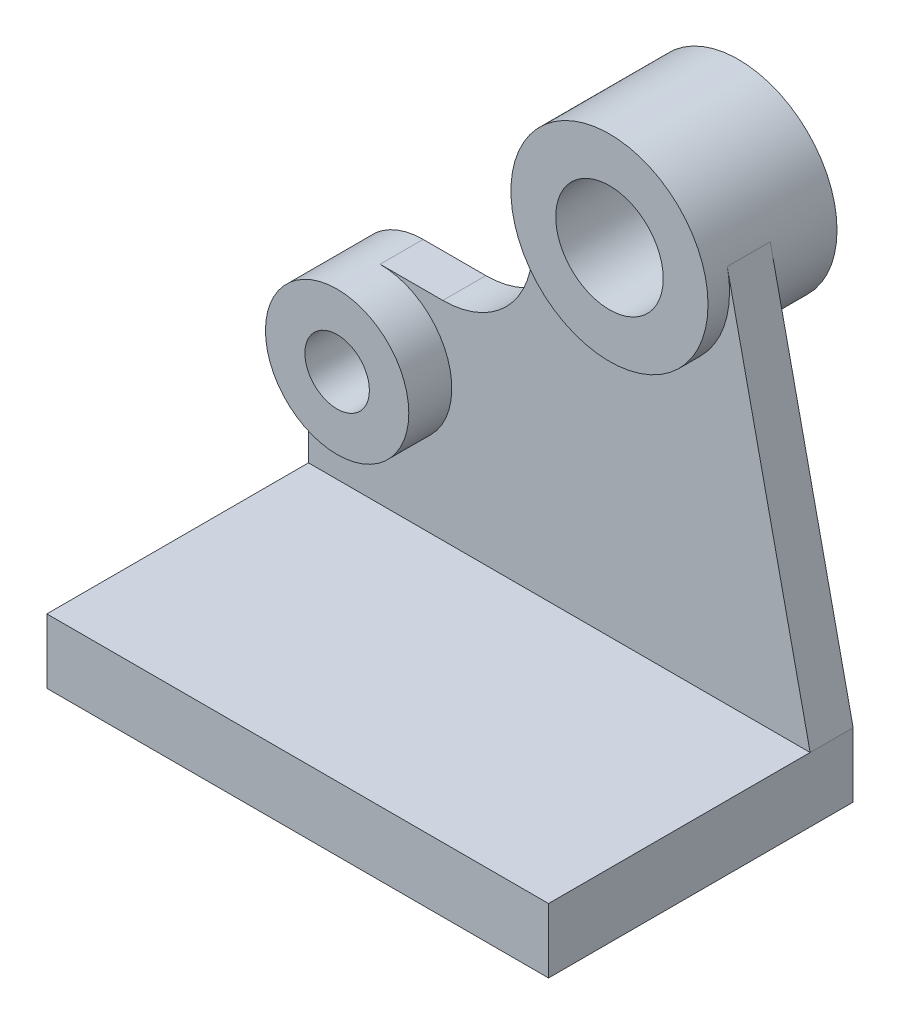
from build123d import *

# Parameters (mm, degrees)
BOSS_EXTRUDE1_DEPTH = 12
SKETCH2_3_R         = 9
BOSS_EXTRUDE2_DEPTH = 24
SKETCH2_4_R         = 15
BOSS_EXTRUDE3_DEPTH = 18
BOSS_EXTRUDE4_DEPTH = 85
FILLET1_R           = 25


with BuildPart() as part:
    # Sketch2 → Boss-Extrude1 (new body)
    with BuildSketch(Plane.XY):
        with BuildLine():
            Line((-90, -100), (0, -100))
            Line((0, -100), (50, -100))
            Line((50, -100), (26.866088482, 5.870544241))
            ThreePointArc((26.866088482, 5.870544241), (27.341062829, 2.952335241), (27.5, 0))
            ThreePointArc((27.5, 0), (0, -27.5), (-27.5, 0))
            Line((-27.5, 0), (-27.5, -42))
            Line((-27.5, -42), (-70, -42))
            ThreePointArc((-70, -42), (-55.857864376, -47.857864376), (-50, -62))
            ThreePointArc((-50, -62), (-70, -82), (-90, -62))
            Line((-90, -62), (-90, -100))
        make_face()
    extrude(amount=BOSS_EXTRUDE1_DEPTH)

    # Sketch2<3> → Boss-Extrude2 (add)
    with BuildSketch(Plane.XY):
        with BuildLine():
            ThreePointArc((-70, -42), (-84.142135624, -47.857864376), (-90, -62))
            ThreePointArc((-90, -62), (-70, -82), (-50, -62))
            ThreePointArc((-50, -62), (-55.857864376, -47.857864376), (-70, -42))
        make_face()
        with Locations((-70, -62)):
            Circle(SKETCH2_3_R, mode=Mode.SUBTRACT)
    extrude(amount=BOSS_EXTRUDE2_DEPTH)

    # Sketch2<4> → Boss-Extrude3 (add, symmetric)
    with BuildSketch(Plane.XY):
        with BuildLine():
            ThreePointArc((27.5, 0), (27.341062829, 2.952335241), (26.866088482, 5.870544241))
            ThreePointArc((26.866088482, 5.870544241), (-2.952335241, 27.341062829), (-27.5, 0))
            ThreePointArc((-27.5, 0), (0, -27.5), (27.5, 0))
        make_face()
        Circle(SKETCH2_4_R, mode=Mode.SUBTRACT)
    extrude(amount=BOSS_EXTRUDE3_DEPTH, both=True)

    # Sketch2<5> → Boss-Extrude4 (add)
    with BuildSketch(Plane.XY):
        Polygon((50, -100), (0, -100), (-90, -100), (-90, -118), (50, -118), align=None)
    extrude(amount=BOSS_EXTRUDE4_DEPTH)

    # Fillet1
    fillet1_edges = [part.edges().sort_by_distance(p)[0] for p in [
        (-27.5, -42, 6),
    ]]
    fillet(fillet1_edges, radius=FILLET1_R)


solid = part.part
